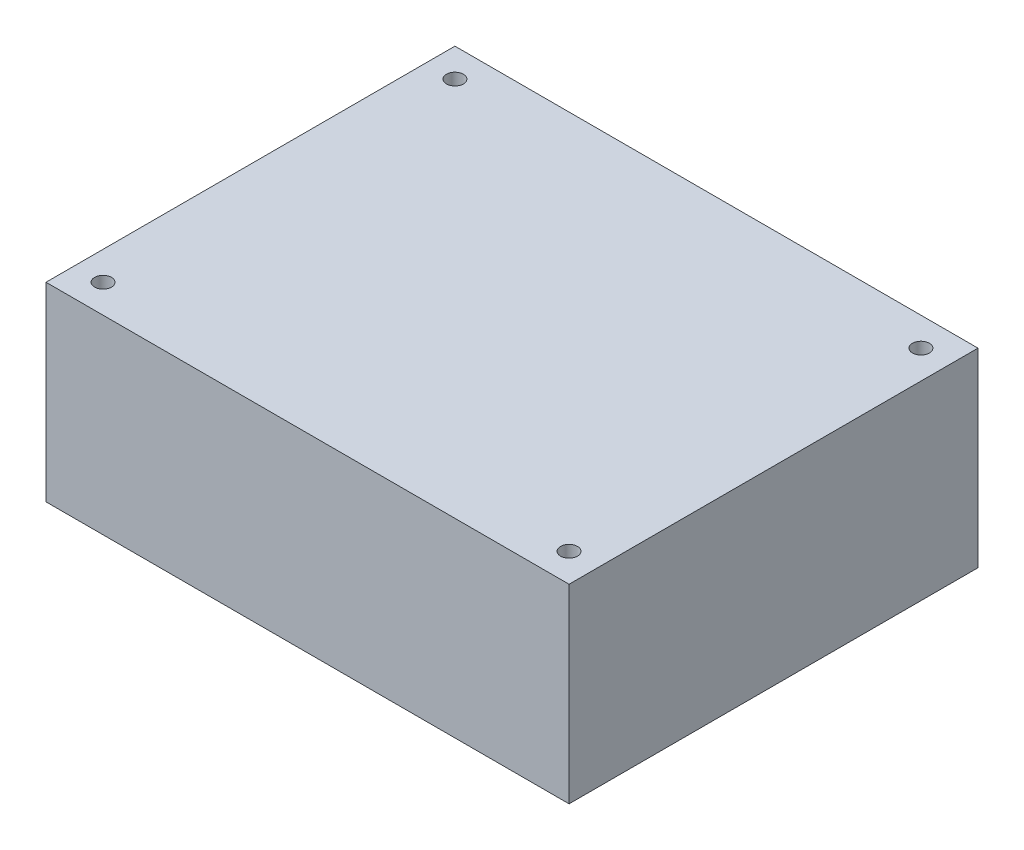
from build123d import *

# Parameters (mm, degrees)
SKETCH1_W           = 69.85
SKETCH1_H           = 54.61
BOSS_EXTRUDE1_DEPTH = 25.4
SKETCH2_R           = 1.1303
CUT_EXTRUDE1_DEPTH  = 25.4


with BuildPart() as part:
    # Sketch1 → Boss-Extrude1 (new body)
    with BuildSketch(Plane(origin=(0, 0, 0), x_dir=(1, 0, 0), z_dir=(0, 1, 0))):
        Rectangle(SKETCH1_W, SKETCH1_H)
    extrude(amount=BOSS_EXTRUDE1_DEPTH)

    # Sketch2 → Cut-Extrude1 (cut)
    with BuildSketch(Plane(origin=(0, 25.4, 0), x_dir=(1, 0, 0), z_dir=(0, 1, 0))):
        with Locations(Location((-31.115, 23.495, 0), (0, 0, 270))):
            Circle(SKETCH2_R)
        with Locations(Location((31.115, 23.495, 0), (0, 0, 270))):
            Circle(SKETCH2_R)
        with Locations(Location((31.115, -23.495, 0), (0, 0, 270))):
            Circle(SKETCH2_R)
        with Locations(Location((-31.115, -23.495, 0), (0, 0, 270))):
            Circle(SKETCH2_R)
    extrude(amount=-CUT_EXTRUDE1_DEPTH, mode=Mode.SUBTRACT)


solid = part.part
